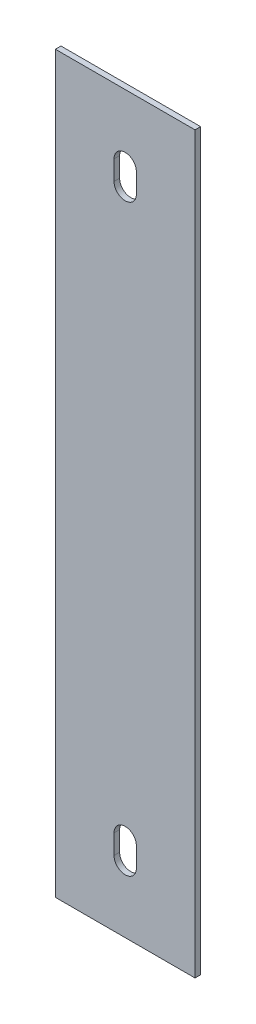
from build123d import *

# Parameters (mm, degrees)
SKETCH1_W           = 50
SKETCH1_H           = 263
BOSS_EXTRUDE1_DEPTH = 2
CUT_EXTRUDE1_DEPTH  = 134.870273026


with BuildPart() as part:
    # Sketch1 → Boss-Extrude1 (new body)
    with BuildSketch(Plane.XY):
        Rectangle(SKETCH1_W, SKETCH1_H)
    extrude(amount=BOSS_EXTRUDE1_DEPTH)

    # Sketch2 → Cut-Extrude1 (cut, through all)
    with BuildSketch(Plane.XY.offset(2)):
        with BuildLine():
            Line((-4, -108), (-4, -101))
            ThreePointArc((-4, -101), (0, -97), (4, -101))
            Line((4, -101), (4, -108))
            ThreePointArc((4, -108), (0, -112), (-4, -108))
        make_face()
        with BuildLine():
            Line((-4, 108), (-4, 101))
            ThreePointArc((-4, 101), (0, 97), (4, 101))
            Line((4, 101), (4, 108))
            ThreePointArc((4, 108), (0, 112), (-4, 108))
        make_face()
    extrude(amount=-CUT_EXTRUDE1_DEPTH, mode=Mode.SUBTRACT)


solid = part.part
